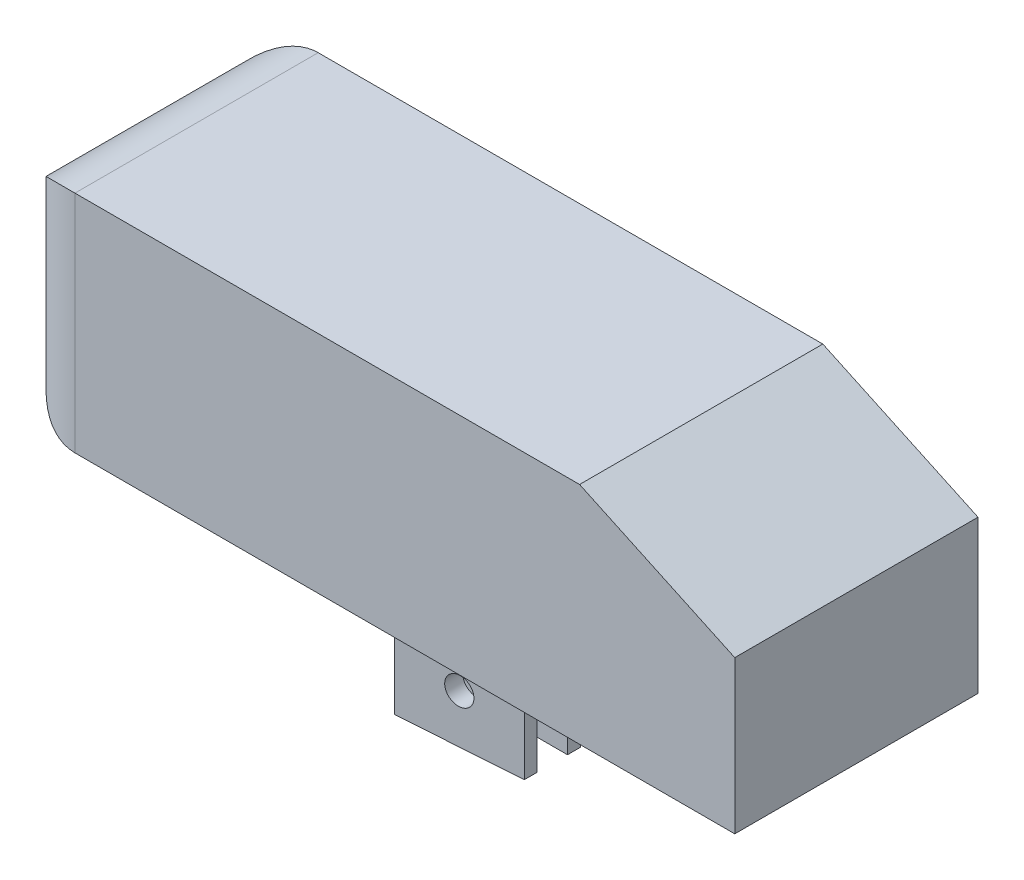
from build123d import *

# Parameters (mm, degrees)
SKETCH1_W            = 1044
SKETCH1_H            = 348
BOSS_EXTRUDE1_DEPTH  = 321.9
CHAMFER2_SIZE        = 222
CHAMFER2_SIZE2       = 103.52030011
FILLET1_R            = 100
SCALE1_SCALE         = 0.115
SKETCH175_W          = 20
SKETCH175_H          = 12
BOSS_EXTRUDE12_DEPTH = 25
SKETCH176_W          = 5
SKETCH176_H          = 25
CUT_EXTRUDE1_DEPTH   = 30
SKETCH177_R          = 2.25
CUT_EXTRUDE2_DEPTH   = 30
CUT_EXTRUDE4_DEPTH   = 25


with BuildPart() as part:
    # Sketch1 → Boss-Extrude1 (new body)
    with BuildSketch(Plane(origin=(0, 0, 0), x_dir=(1, 0, 0), z_dir=(0, 1, 0))):
        Rectangle(SKETCH1_W, SKETCH1_H)
    extrude(amount=BOSS_EXTRUDE1_DEPTH)

    # Chamfer2
    chamfer2_edges = [part.edges().sort_by_distance(p)[0] for p in [
        (522, 321.9, 0),
    ]]
    chamfer2_side = [part.faces().sort_by_distance(p)[0] for p in [
        (0, 321.9, 0),
    ]]
    chamfer(chamfer2_edges, length=CHAMFER2_SIZE, length2=CHAMFER2_SIZE2, reference=chamfer2_side[0])

    # Fillet1
    fillet1_edges = [part.edges().sort_by_distance(p)[0] for p in [
        (-522, 321.9, 0),
        (-522, 0, 0),
        (-522, 160.95, -174),
        (-522, 160.95, 174),
    ]]
    fillet(fillet1_edges, radius=FILLET1_R)


with BuildPart() as part_1:
    # Scale1: scaled about (-4.978902211, 156.372589253, 0)
    add(part.part.scale(SCALE1_SCALE).moved(Location((-4.406328457, 138.389741489, 0))))


with BuildPart() as boss_extrude12_tool:
    # Sketch175 → Boss-Extrude12 (new body)
    with BuildSketch(Plane.XZ.offset(-138.389734505)):
        with Locations((-4.405349795, 0)):
            Rectangle(SKETCH175_W, SKETCH175_H)
    extrude(amount=BOSS_EXTRUDE12_DEPTH)


with BuildPart() as part_2:
    add(part_1.part)


with BuildPart() as part_3:
    # Boss-Extrude12: joined with boss_extrude12_tool
    add(part_2.part.fuse(boss_extrude12_tool.part, tol=0.00001))

    # Sketch176 → Cut-Extrude1 (cut)
    with BuildSketch(Plane(origin=(5.594650205, 0, 0), x_dir=(0, 0, -1), z_dir=(1, 0, 0))):
        with Locations((0, 125.889734505)):
            Rectangle(SKETCH176_W, SKETCH176_H)
    extrude(amount=-CUT_EXTRUDE1_DEPTH, mode=Mode.SUBTRACT)

    # Sketch177 → Cut-Extrude2 (cut)
    with BuildSketch(Plane(origin=(0, 0, -6), x_dir=(-1, 0, 0), z_dir=(0, 0, -1))):
        with Locations((4.405349795, 121.389734505)):
            Circle(SKETCH177_R)
    extrude(amount=-CUT_EXTRUDE2_DEPTH, mode=Mode.SUBTRACT)

    # Sketch179 → Cut-Extrude4 (cut)
    with BuildSketch(Plane.XZ.offset(-113.389734505)):
        Polygon((-14.405349795, 6), (20.594650205, 3.552561582), (20.594650205, -3.552561582), (-14.405349795, -6), (23.594650205, -6), (23.594650205, 6), align=None)
    extrude(amount=-CUT_EXTRUDE4_DEPTH, mode=Mode.SUBTRACT)


solid = part_3.part
